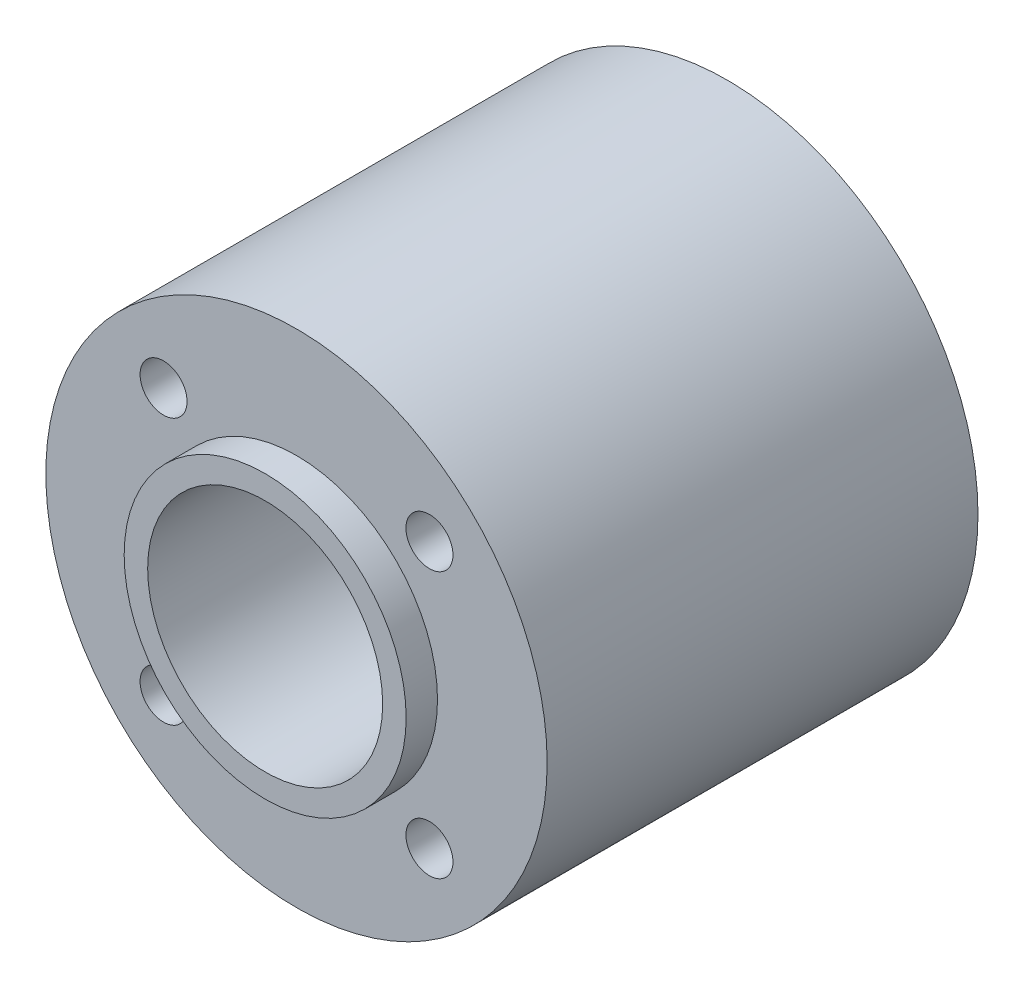
from build123d import *

# Parameters (mm, degrees)
SKETCH1_R           = 16
SKETCH1_R_2         = 9
SKETCH1_R_3         = 7.5
BOSS_EXTRUDE1_DEPTH = 27.5
BOSS_EXTRUDE2_START = 2
SKETCH1_4_R         = 9
SKETCH1_4_R_2       = 7.5
BOSS_EXTRUDE2_DEPTH = 2
BOSS_EXTRUDE3_START = -27.5
SKETCH1_5_R         = 9
SKETCH1_5_R_2       = 7.5
BOSS_EXTRUDE3_DEPTH = 2
SKETCH2_R           = 1.5
CUT_EXTRUDE1_DEPTH  = 38.17862289


with BuildPart() as part:
    # Sketch1 → Boss-Extrude1 (new body)
    # profile 1 of 2: a face of its own
    with BuildSketch(Plane.XY):
        Circle(SKETCH1_R)
        Circle(SKETCH1_R_2, mode=Mode.SUBTRACT)
    # profile 2 of 2: a face of its own
    with BuildSketch(Plane.XY):
        Circle(SKETCH1_R_2)
        Circle(SKETCH1_R_3, mode=Mode.SUBTRACT)
    extrude(amount=-BOSS_EXTRUDE1_DEPTH)

    # Sketch1<4> → Boss-Extrude2 (add)
    with BuildSketch(Plane.XY.offset(BOSS_EXTRUDE2_START)):
        Circle(SKETCH1_4_R)
        Circle(SKETCH1_4_R_2, mode=Mode.SUBTRACT)
    extrude(amount=-BOSS_EXTRUDE2_DEPTH)

    # Sketch1<5> → Boss-Extrude3 (add)
    with BuildSketch(Plane.XY.offset(BOSS_EXTRUDE3_START)):
        Circle(SKETCH1_5_R)
        Circle(SKETCH1_5_R_2, mode=Mode.SUBTRACT)
    extrude(amount=-BOSS_EXTRUDE3_DEPTH)

    # Sketch2 → Cut-Extrude1 (cut, through all)
    with BuildSketch(Plane.XY):
        with Locations((-8.485281374, 8.485281374)):
            Circle(SKETCH2_R)
        with Locations((8.485281374, 8.485281374)):
            Circle(SKETCH2_R)
        with Locations((8.485281374, -8.485281374)):
            Circle(SKETCH2_R)
        with Locations((-8.485281374, -8.485281374)):
            Circle(SKETCH2_R)
    extrude(amount=-CUT_EXTRUDE1_DEPTH, mode=Mode.SUBTRACT)


solid = part.part
